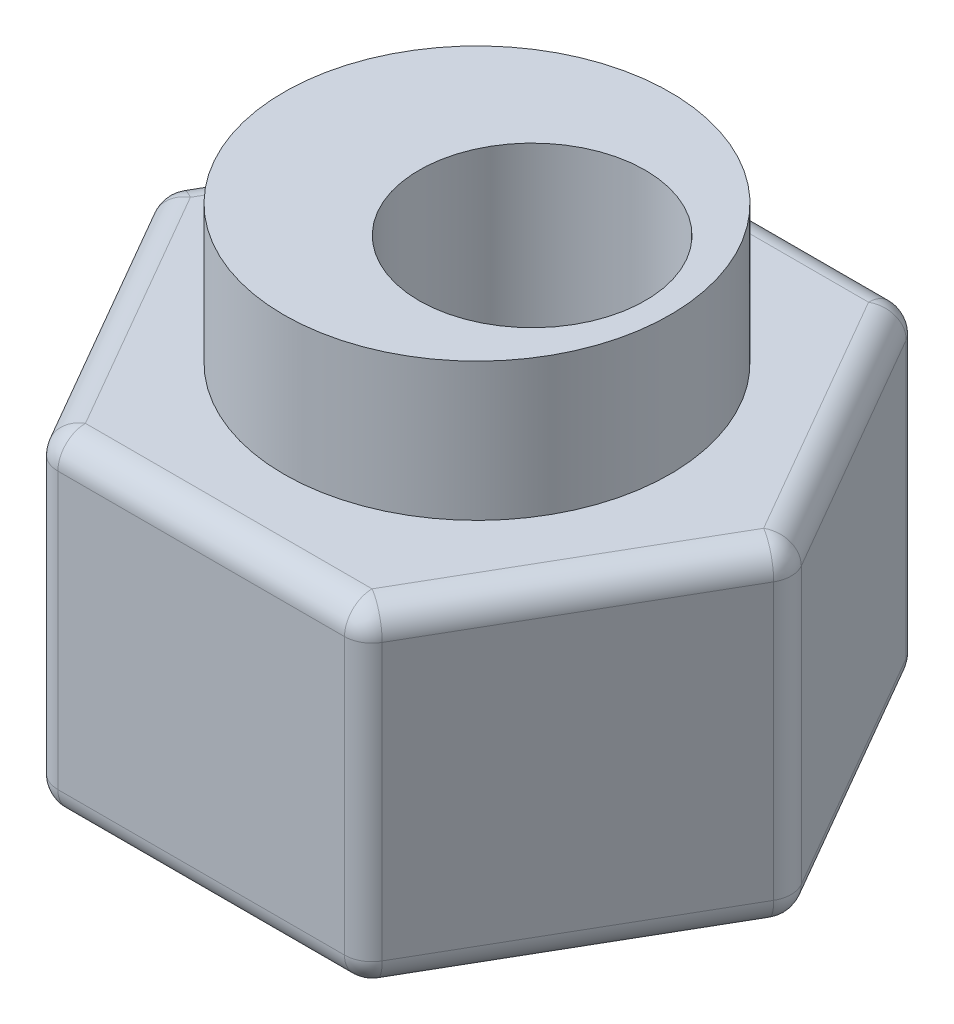
from build123d import *

# Parameters (mm, degrees)
BOSS_EXTRUDE1_DEPTH = 6
SKETCH2_R           = 3.5
BOSS_EXTRUDE2_DEPTH = 2.5
SKETCH4_R           = 2.05
CUT_EXTRUDE1_DEPTH  = 12.427306478
FILLET1_R           = 0.5


with BuildPart() as part:
    # Sketch1 → Boss-Extrude1 (new body)
    with BuildSketch(Plane(origin=(0, 0, 0), x_dir=(1, 0, 0), z_dir=(0, 1, 0))):
        Polygon((-2.886751346, 5), (-5.773502692, 0), (-2.886751346, -5), (2.886751346, -5), (5.773502692, 0), (2.886751346, 5), align=None)
    extrude(amount=BOSS_EXTRUDE1_DEPTH)

    # Sketch2 → Boss-Extrude2 (add)
    with BuildSketch(Plane(origin=(0, 6, 0), x_dir=(1, 0, 0), z_dir=(0, 1, 0))):
        with Locations(Location((0, 0, 0), (0, 0, 270))):
            Circle(SKETCH2_R)
    extrude(amount=BOSS_EXTRUDE2_DEPTH)

    # Sketch4 → Cut-Extrude1 (cut, through all)
    with BuildSketch(Plane(origin=(0, 8.5, 0), x_dir=(1, 0, 0), z_dir=(0, 1, 0))):
        with Locations(Location((1, 0, 0), (0, 0, 270))):
            Circle(SKETCH4_R)
    extrude(amount=-CUT_EXTRUDE1_DEPTH, mode=Mode.SUBTRACT)

    # Fillet1
    fillet1_edges = [part.edges().sort_by_distance(p)[0] for p in [
        (-4.330127019, 6, 2.5),
        (2.886751346, 3, -5),
        (5.773502692, 3, 0),
        (2.886751346, 3, 5),
        (-2.886751346, 3, 5),
        (-5.773502692, 3, 0),
        (-2.886751346, 3, -5),
        (0, 6, 5),
        (4.330127019, 6, 2.5),
        (4.330127019, 6, -2.5),
        (0, 6, -5),
        (4.330127019, 0, -2.5),
        (4.330127019, 0, 2.5),
        (0, 0, 5),
        (-4.330127019, 6, -2.5),
        (-4.330127019, 0, 2.5),
        (-4.330127019, 0, -2.5),
        (0, 0, -5),
    ]]
    fillet(fillet1_edges, radius=FILLET1_R)


solid = part.part
